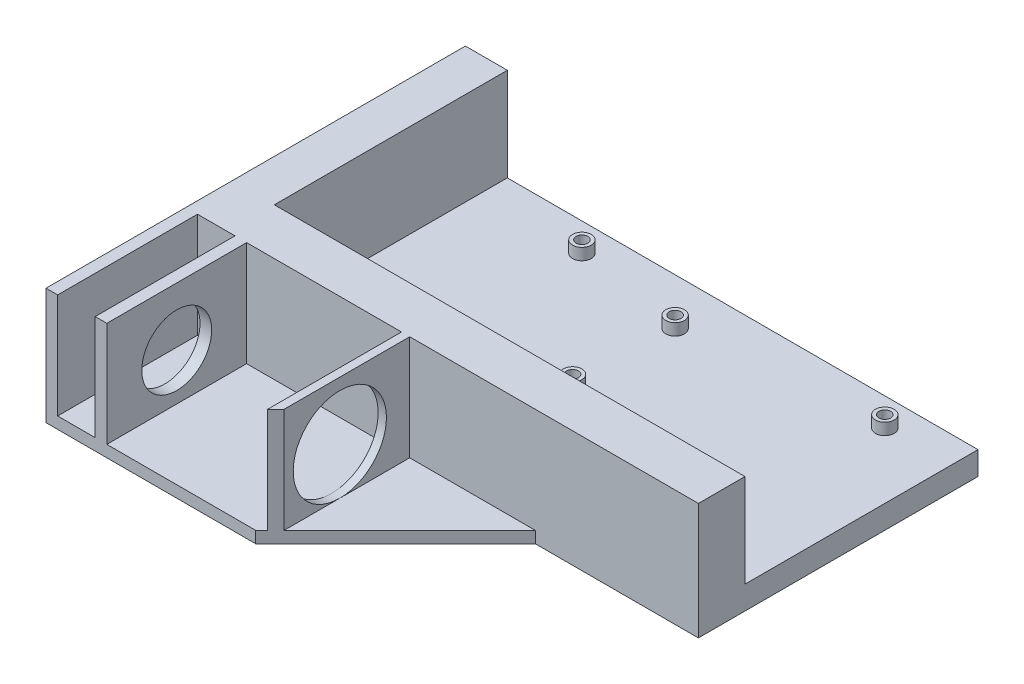
from build123d import *

# Parameters (mm, degrees)
SKETCH1_W           = 139.7
SKETCH1_H           = 76.2
BOSS_EXTRUDE1_DEPTH = 31.75
SKETCH2_W           = 128.27
SKETCH2_H           = 63.545947231
CUT_EXTRUDE1_DEPTH  = 25.4
SKETCH3_W           = 10.16
SKETCH3_H           = 10.16
BOSS_EXTRUDE3_DEPTH = 12.7
SKETCH4_R           = 2.032
CUT_EXTRUDE2_DEPTH  = 82.814026915
SKETCH5_R           = 3.937
CUT_EXTRUDE3_DEPTH  = 2.286
SKETCH7_R           = 2.54
SKETCH7_R_2         = 1.6002
BOSS_EXTRUDE5_DEPTH = 3.175
BOSS_EXTRUDE6_DEPTH = 3.175
SKETCH9_W           = 3.175
SKETCH9_H           = 38.1
BOSS_EXTRUDE7_DEPTH = 28.575
SKETCH10_R          = 5.5499
CUT_EXTRUDE4_DEPTH  = 3.175
SKETCH11_R          = 9.525
CUT_EXTRUDE5_DEPTH  = 3.175
SKETCH12_R          = 12.7
CUT_EXTRUDE6_DEPTH  = 3.175


with BuildPart() as part:
    # Sketch1 → Boss-Extrude1 (new body)
    with BuildSketch(Plane(origin=(0, 0, 0), x_dir=(1, 0, 0), z_dir=(0, 1, 0))):
        Rectangle(SKETCH1_W, SKETCH1_H)
    extrude(amount=BOSS_EXTRUDE1_DEPTH)

    # Sketch2 → Cut-Extrude1 (cut)
    with BuildSketch(Plane(origin=(0, 31.75, 0), x_dir=(1, 0, 0), z_dir=(0, 1, 0))):
        with Locations((5.715, 6.372973615)):
            Rectangle(SKETCH2_W, SKETCH2_H)
    extrude(amount=-CUT_EXTRUDE1_DEPTH, mode=Mode.SUBTRACT)

    # Sketch3 → Boss-Extrude3 (add)
    with BuildSketch(Plane(origin=(0, 6.35, 0), x_dir=(1, 0, 0), z_dir=(0, 1, 0))):
        with Locations((-53.34, -20.32)):
            Rectangle(SKETCH3_W, SKETCH3_H)
    extrude(amount=BOSS_EXTRUDE3_DEPTH)

    # Sketch4 → Cut-Extrude2 (cut, through all)
    with BuildSketch(Plane(origin=(0, 19.05, 0), x_dir=(1, 0, 0), z_dir=(0, 1, 0))):
        with Locations(Location((-53.34, -20.32, 0), (0, 0, 270))):
            Circle(SKETCH4_R)
    extrude(amount=-CUT_EXTRUDE2_DEPTH, mode=Mode.SUBTRACT)

    # Sketch5 → Cut-Extrude3 (cut)
    with BuildSketch(Plane(origin=(0, 19.05, 0), x_dir=(1, 0, 0), z_dir=(0, 1, 0))):
        with Locations(Location((-53.34, -20.32, 0), (0, 0, 270))):
            Circle(SKETCH5_R)
    extrude(amount=-CUT_EXTRUDE3_DEPTH, mode=Mode.SUBTRACT)

    # Sketch7 → Boss-Extrude5 (add)
    # profile 1 of 6: a face of its own
    with BuildSketch(Plane(origin=(0, 6.35, 0), x_dir=(1, 0, 0), z_dir=(0, 1, 0))):
        with Locations(Location((-30.48, 30.48, 0), (0, 0, 90))):
            Circle(SKETCH7_R)
        with Locations(Location((-30.48, 30.48, 0), (0, 0, 270))):
            Circle(SKETCH7_R_2, mode=Mode.SUBTRACT)
    # profile 2 of 6: a face of its own
    with BuildSketch(Plane(origin=(0, 6.35, 0), x_dir=(1, 0, 0), z_dir=(0, 1, 0))):
        with Locations(Location((-24.13, -17.78, 0), (0, 0, 90))):
            Circle(SKETCH7_R)
        with Locations(Location((-24.13, -17.78, 0), (0, 0, 270))):
            Circle(SKETCH7_R_2, mode=Mode.SUBTRACT)
    # profile 3 of 6: a face of its own
    with BuildSketch(Plane(origin=(0, 6.35, 0), x_dir=(1, 0, 0), z_dir=(0, 1, 0))):
        with Locations(Location((0, 25.4, 0), (0, 0, 90))):
            Circle(SKETCH7_R)
        with Locations(Location((0, 25.4, 0), (0, 0, 270))):
            Circle(SKETCH7_R_2, mode=Mode.SUBTRACT)
    # profile 4 of 6: a face of its own
    with BuildSketch(Plane(origin=(0, 6.35, 0), x_dir=(1, 0, 0), z_dir=(0, 1, 0))):
        with Locations(Location((0, -2.54, 0), (0, 0, 90))):
            Circle(SKETCH7_R)
        with Locations(Location((0, -2.54, 0), (0, 0, 270))):
            Circle(SKETCH7_R_2, mode=Mode.SUBTRACT)
    # profile 5 of 6: a face of its own
    with BuildSketch(Plane(origin=(0, 6.35, 0), x_dir=(1, 0, 0), z_dir=(0, 1, 0))):
        with Locations(Location((50.8, -17.78, 0), (0, 0, 90))):
            Circle(SKETCH7_R)
        with Locations(Location((50.8, -17.78, 0), (0, 0, 270))):
            Circle(SKETCH7_R_2, mode=Mode.SUBTRACT)
    # profile 6 of 6: a face of its own
    with BuildSketch(Plane(origin=(0, 6.35, 0), x_dir=(1, 0, 0), z_dir=(0, 1, 0))):
        with Locations(Location((52.07, 30.48, 0), (0, 0, 90))):
            Circle(SKETCH7_R)
        with Locations(Location((52.07, 30.48, 0), (0, 0, 270))):
            Circle(SKETCH7_R_2, mode=Mode.SUBTRACT)
    extrude(amount=BOSS_EXTRUDE5_DEPTH)

    # Sketch8 → Boss-Extrude6 (add)
    with BuildSketch(Plane.XZ):
        Polygon((-69.85, 38.1), (-69.85, 76.2), (-12.7, 76.2), (25.4, 38.1), align=None)
    extrude(amount=-BOSS_EXTRUDE6_DEPTH)

    # Sketch9 → Boss-Extrude7 (add)
    with BuildSketch(Plane(origin=(0, 3.175, 0), x_dir=(1, 0, 0), z_dir=(0, 1, 0))):
        with Locations((-68.2625, -57.15)):
            Rectangle(SKETCH9_W, SKETCH9_H)
        Polygon((-8.8265, -72.3265), (-11.07156403, -74.57156403), (-11.07156403, -38.1), (-8.8265, -38.1), align=None)
        with Locations((-54.864, -57.15)):
            Rectangle(SKETCH9_W, SKETCH9_H)
    extrude(amount=BOSS_EXTRUDE7_DEPTH)

    # Sketch10 → Cut-Extrude4 (cut)
    with BuildSketch(Plane.ZY.offset(69.85)):
        with Locations((57.15, 15.875)):
            Circle(SKETCH10_R)
    extrude(amount=-CUT_EXTRUDE4_DEPTH, mode=Mode.SUBTRACT)

    # Sketch11 → Cut-Extrude5 (cut)
    with BuildSketch(Plane.ZY.offset(56.4515)):
        with Locations((57.15, 15.875)):
            Circle(SKETCH11_R)
    extrude(amount=-CUT_EXTRUDE5_DEPTH, mode=Mode.SUBTRACT)

    # Sketch12 → Cut-Extrude6 (cut)
    with BuildSketch(Plane.ZY.offset(11.07156403)):
        with Locations(Location((57.15, 15.875, 0), (0, 0, 270))):
            Circle(SKETCH12_R)
    extrude(amount=-CUT_EXTRUDE6_DEPTH, mode=Mode.SUBTRACT)


solid = part.part
